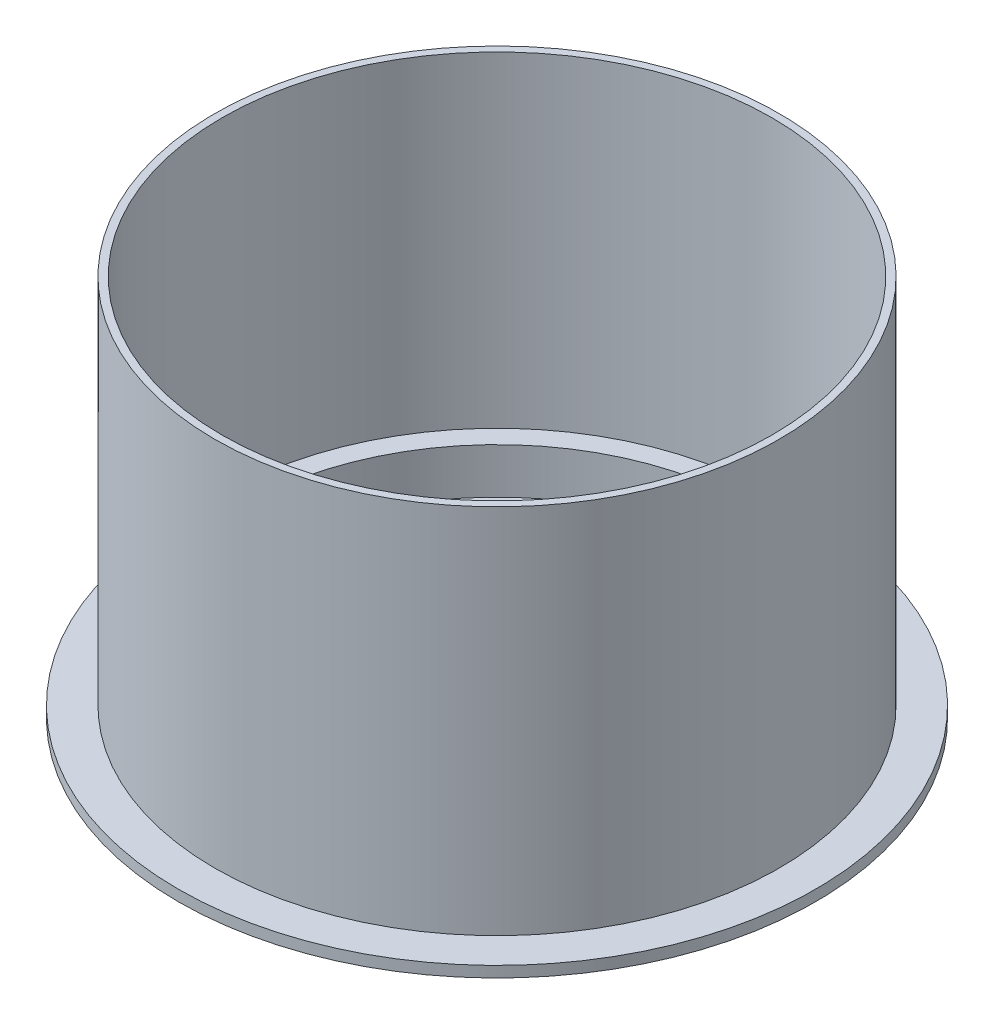
from build123d import *

# Parameters (mm, degrees)
FLOOR_SKETCH_R          = 175
FLOOR_SKETCH_R_2        = 12.5
FLOOR_TANK_LID_DEPTH    = 6
BASKET_LEDGE_SKETCH_R   = 152
BASKET_LEDGE_SKETCH_R_2 = 140
BASKET_LEDGE_DEPTH      = 31
HOUSING_WALL_SKETCH_R   = 155
HOUSING_WALL_SKETCH_R_2 = 151
HOUSING_WALL_DEPTH      = 210


with BuildPart() as part:
    # Floor Sketch → Floor - Tank Lid (new body)
    with BuildSketch(Plane(origin=(0, 0, 0), x_dir=(1, 0, 0), z_dir=(0, 1, 0))):
        with Locations(Location((0, 0, 0), (0, 0, 270))):
            Circle(FLOOR_SKETCH_R)
        with Locations(Location((0, 0, 0), (0, 0, 270))):
            Circle(FLOOR_SKETCH_R_2, mode=Mode.SUBTRACT)
    extrude(amount=FLOOR_TANK_LID_DEPTH)

    # Basket Ledge Sketch → Basket Ledge (add)
    with BuildSketch(Plane(origin=(0, 0, 0), x_dir=(1, 0, 0), z_dir=(0, 1, 0))):
        with Locations(Location((0, 0, 0), (0, 0, 270))):
            Circle(BASKET_LEDGE_SKETCH_R)
        with Locations(Location((0, 0, 0), (0, 0, 270))):
            Circle(BASKET_LEDGE_SKETCH_R_2, mode=Mode.SUBTRACT)
    extrude(amount=BASKET_LEDGE_DEPTH)

    # Housing Wall Sketch → Housing Wall (add)
    with BuildSketch(Plane(origin=(0, 0, 0), x_dir=(1, 0, 0), z_dir=(0, 1, 0))):
        with Locations(Location((0, 0, 0), (0, 0, 270))):
            Circle(HOUSING_WALL_SKETCH_R)
        with Locations(Location((0, 0, 0), (0, 0, 270))):
            Circle(HOUSING_WALL_SKETCH_R_2, mode=Mode.SUBTRACT)
    extrude(amount=HOUSING_WALL_DEPTH)


solid = part.part
